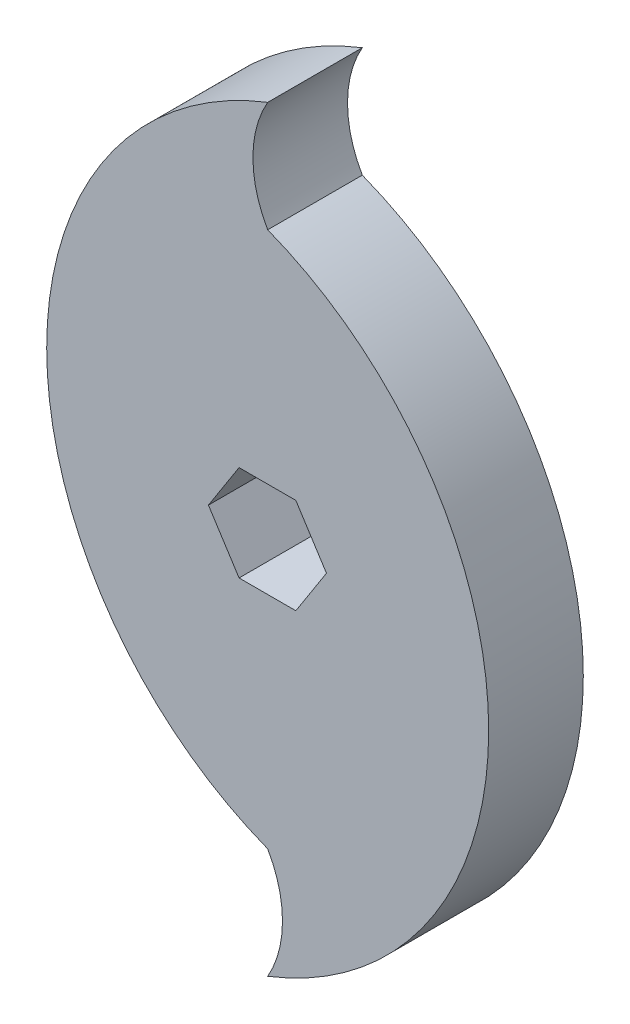
from build123d import *

# Parameters (mm, degrees)
BOSS_EXTRU_2_DEPTH      = 30
ENL_V_MAT_EXTRU_1_DEPTH = 252.815317877


with BuildPart() as part:
    # Esquisse1 → Boss.-Extru.2 (new body)
    with BuildSketch(Plane.XY):
        with BuildLine():
            ThreePointArc((0, -205), (-70.078201443, -102.5), (0, 0))
            ThreePointArc((0, 0), (-4.689110868, -17.5), (0, -35))
            ThreePointArc((0, -35), (70.078201443, -137.5), (0, -240))
            ThreePointArc((0, -240), (4.689110868, -222.5), (0, -205))
        make_face()
    extrude(amount=BOSS_EXTRU_2_DEPTH)

    # Esquisse3 → Enlèv. mat.-Extru.1 (cut, through all)
    with BuildSketch(Plane.XY.offset(30)):
        Polygon((-9.078201443, -104.84640345), (8.921798557, -104.84640345), (18.636144216, -120), (8.921798557, -135.15359655), (-9.078201443, -135.15359655), (-18.792547103, -120), align=None)
    extrude(amount=-ENL_V_MAT_EXTRU_1_DEPTH, mode=Mode.SUBTRACT)


solid = part.part
